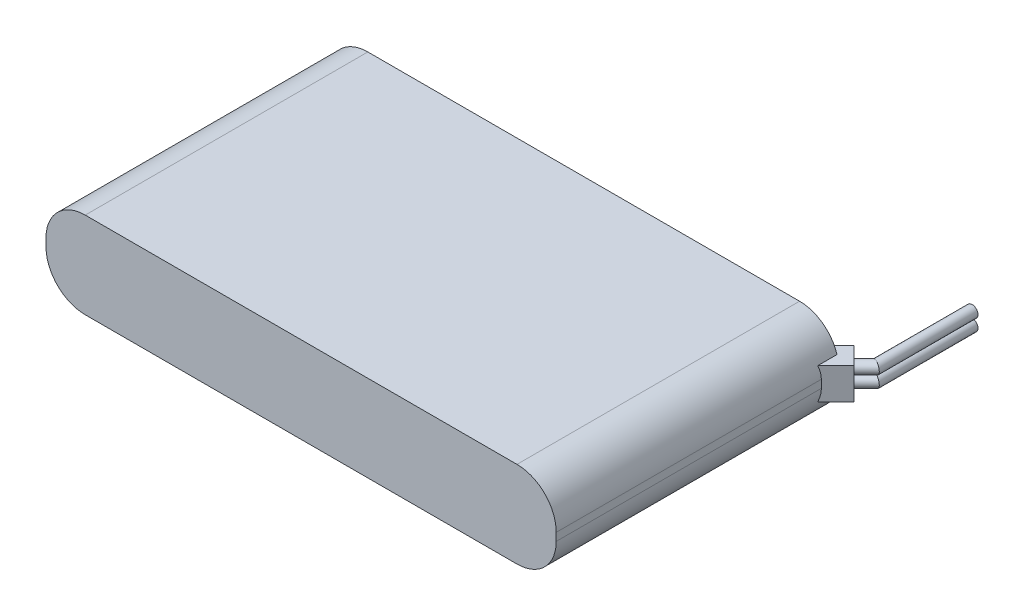
from build123d import *

# Parameters (mm, degrees)
SKETCH_1_W         = 130
SKETCH_1_H         = 72
EXTRUDE_1_DEPTH    = 22
FILLET_2_R         = 10
EXTRUDE_2_DEPTH    = 4
SWEEP_15_PROFILE_R = 1.475


with BuildPart() as part:
    # 草图1 → 凸台-拉伸1 (new body)
    with BuildSketch(Plane(origin=(0, 0, 0), x_dir=(1, 0, 0), z_dir=(0, 1, 0))):
        with Locations((2.770491803, 5.131147541)):
            Rectangle(SKETCH_1_W, SKETCH_1_H)
    extrude(amount=EXTRUDE_1_DEPTH)

    # 圆角2
    fillet_2_edges = [part.edges().sort_by_distance(p)[0] for p in [
        (67.770491803, 22, -5.131147541),
        (-62.229508197, 22, -5.131147541),
        (67.770491803, 0, -5.131147541),
        (-62.229508197, 0, -5.131147541),
    ]]
    fillet(fillet_2_edges, radius=FILLET_2_R)

    # 草图2 → 凸台-拉伸2 (add, symmetric)
    with BuildSketch(Plane(origin=(0, 11, 0), x_dir=(-1, 0, 0), z_dir=(0, -1, 0))):
        Polygon((-62.533388889, 40.348817348), (-66.98816161, 35.894044627), (-71.937909079, 40.843792095), (-67.483136357, 45.298564816), align=None)
    extrude(amount=EXTRUDE_2_DEPTH, both=True)

    # 扫描15: sweep along a path in 草图66
    with BuildLine(Plane(origin=(0, 12.5, 0), x_dir=(1, 0, 0), z_dir=(0, 1, 0))) as sweep_15_path:
        Line((69.689066092, 43.092635082), (72.470448318, 45.874017309))
        Line((72.470448318, 45.874017309), (72.470448318, 70.417467586))
    # 扫描15 profile (on start of the path) → 扫描15 (sweep)
    with BuildSketch(Plane(origin=(69.689066092, 12.5, -43.092635082), x_dir=(-0.7071067811865476, 0, -0.7071067811865476), z_dir=(0.7071067811865476, 0, -0.7071067811865476))):
        Circle(SWEEP_15_PROFILE_R)
    sweep_15 = sweep(path=sweep_15_path.line, transition=Transition.RIGHT)

    # 镜向1: 扫描15 across plane
    add(sweep_15.mirror(Plane(origin=(0, 11, 0), x_dir=(0, 0, 1), z_dir=(0, -1, 0))))


solid = part.part
